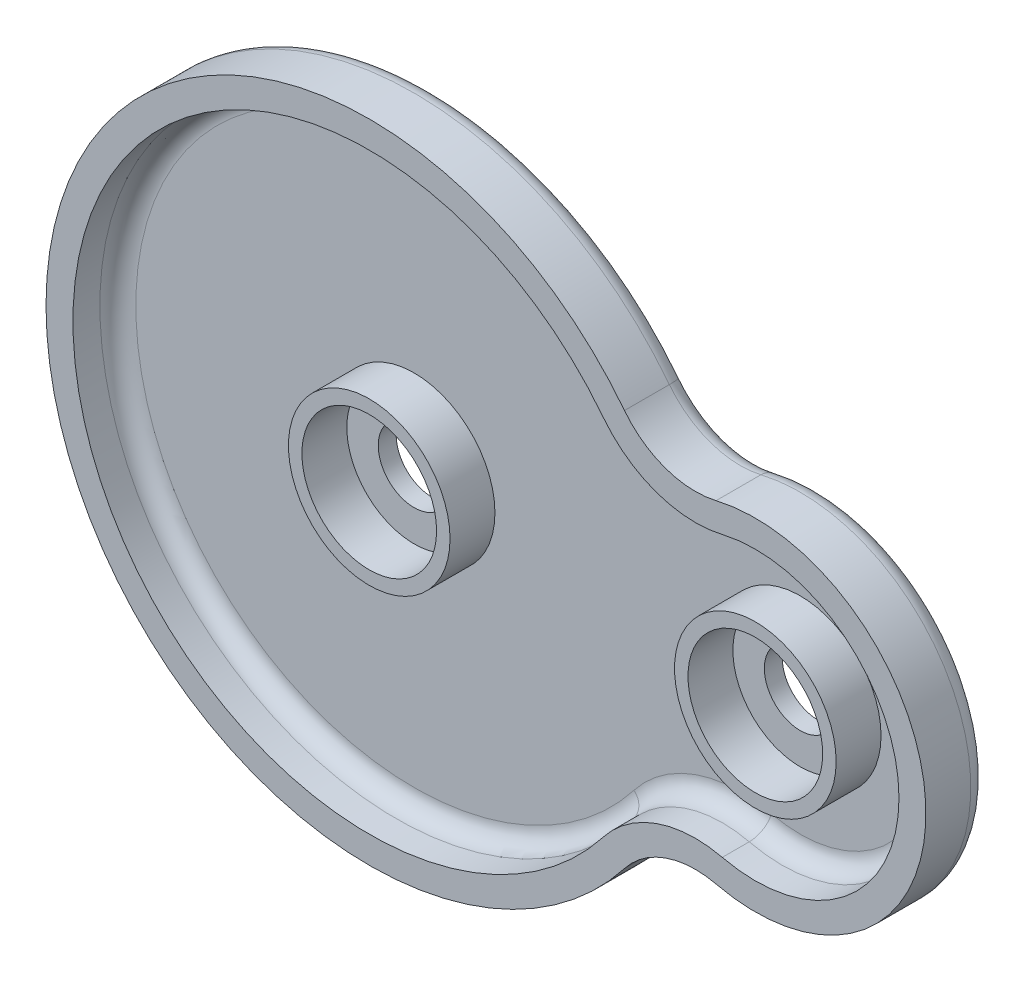
from build123d import *

# Parameters (mm, degrees)
SKETCH1_R           = 4
BOSS_EXTRUDE1_DEPTH = 2
SKETCH1_3_R         = 9
SKETCH1_3_R_2       = 7.5
BOSS_EXTRUDE2_DEPTH = 7
BOSS_EXTRUDE3_DEPTH = 7
FILLET1_R           = 2


with BuildPart() as part:
    # Sketch1 → Boss-Extrude1 (new body)
    with BuildSketch(Plane.XY):
        with BuildLine():
            ThreePointArc((38.627105052, 18.489937528), (32.999839448, 18.790712656), (28.428715875, 22.086378465))
            ThreePointArc((28.428715875, 22.086378465), (-36, 0), (28.428715875, -22.086378465))
            ThreePointArc((28.428715875, -22.086378465), (32.999839448, -18.790712656), (38.627105052, -18.489937528))
            ThreePointArc((38.627105052, -18.489937528), (62, 0), (38.627105052, 18.489937528))
        make_face()
        Circle(SKETCH1_R, mode=Mode.SUBTRACT)
        with Locations((43, 0)):
            Circle(SKETCH1_R, mode=Mode.SUBTRACT)
    extrude(amount=BOSS_EXTRUDE1_DEPTH)

    # Sketch1<3> → Boss-Extrude2 (add)
    # profile 1 of 2: a face of its own
    with BuildSketch(Plane.XY):
        Circle(SKETCH1_3_R)
        Circle(SKETCH1_3_R_2, mode=Mode.SUBTRACT)
    # profile 2 of 2: a face of its own
    with BuildSketch(Plane.XY):
        with Locations((43, 0)):
            Circle(SKETCH1_3_R)
        with Locations((43, 0)):
            Circle(SKETCH1_3_R_2, mode=Mode.SUBTRACT)
    extrude(amount=BOSS_EXTRUDE2_DEPTH)

    # Sketch1<4> → Boss-Extrude3 (add)
    with BuildSketch(Plane.XY):
        with BuildLine():
            ThreePointArc((38.627105052, 18.489937528), (32.999839448, 18.790712656), (28.428715875, 22.086378465))
            ThreePointArc((28.428715875, 22.086378465), (-36, 0), (28.428715875, -22.086378465))
            ThreePointArc((28.428715875, -22.086378465), (32.999839448, -18.790712656), (38.627105052, -18.489937528))
            ThreePointArc((38.627105052, -18.489937528), (62, 0), (38.627105052, 18.489937528))
        make_face()
        with BuildLine():
            ThreePointArc((26.059656218, -20.245846927), (-33, 0), (26.059656218, 20.245846927))
            ThreePointArc((26.059656218, 20.245846927), (32.002116864, 15.961481374), (39.317562149, 15.570473707))
            ThreePointArc((39.317562149, 15.570473707), (59, 0), (39.317562149, -15.570473707))
            ThreePointArc((39.317562149, -15.570473707), (32.002116864, -15.961481374), (26.059656218, -20.245846927))
        make_face(mode=Mode.SUBTRACT)
    extrude(amount=BOSS_EXTRUDE3_DEPTH)

    # Fillet1
    fillet1_edges = [part.edges().sort_by_distance(p)[0] for p in [
        (32.999839448, -18.790712656, 0),
        (-36, 0, 0),
        (32.999839448, 18.790712656, 0),
        (32.002116864, -15.961481374, 2),
        (59, 0, 2),
        (32.002116864, 15.961481374, 2),
        (62, 0, 0),
        (-33, 0, 2),
    ]]
    fillet(fillet1_edges, radius=FILLET1_R)


solid = part.part
